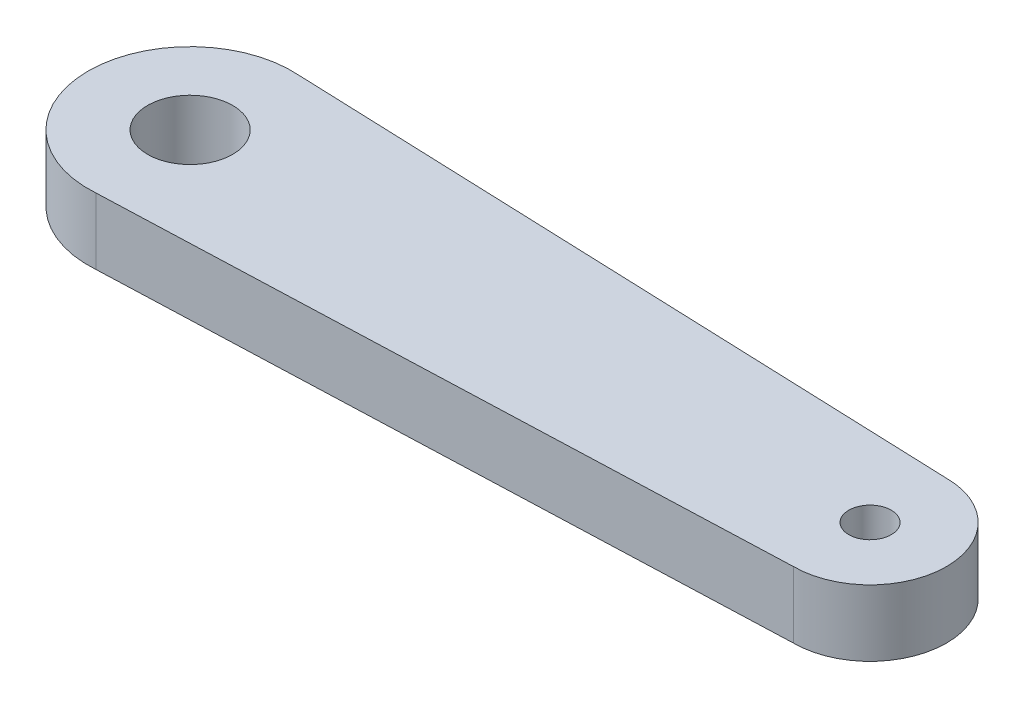
from build123d import *

# Parameters (mm, degrees)
BOSS_EXTRUDE1_DEPTH     = 3.9
CUT_EXTRUDE1_DEPTH      = 16
CUT_EXTRUDE1_DEPTH_BACK = 10.5
SKETCH2_R               = 2.5
SKETCH2_R_2             = 1.25


with BuildPart() as part:
    # Sketch1 → Boss-Extrude1 (new body)
    with BuildSketch(Plane(origin=(0, 0, 0), x_dir=(1, 0, 0), z_dir=(0, 1, 0))):
        with BuildLine():
            Line((0.449368076, 5.983148697), (40, 4.5))
            ThreePointArc((40, 4.5), (44.5, 0), (40, -4.5))
            Line((40, -4.5), (0.449368076, -5.983148697))
            ThreePointArc((0.449368076, -5.983148697), (-6, 0), (0.449368076, 5.983148697))
        make_face()
    extrude(amount=BOSS_EXTRUDE1_DEPTH)

    # Sketch2 → Cut-Extrude1 (cut, two sides: drawn at the far end of the back side and taken through both)
    with BuildSketch(Plane(origin=(0, 3.9, 0), x_dir=(1, 0, 0), z_dir=(0, 1, 0)).offset(-CUT_EXTRUDE1_DEPTH_BACK)):
        with Locations(Location((0, 0, 0), (0, 0, 270))):
            Circle(SKETCH2_R)
        with Locations(Location((40, 0, 0), (0, 0, 270))):
            Circle(SKETCH2_R_2)
    extrude(amount=CUT_EXTRUDE1_DEPTH + CUT_EXTRUDE1_DEPTH_BACK, mode=Mode.SUBTRACT)


solid = part.part
